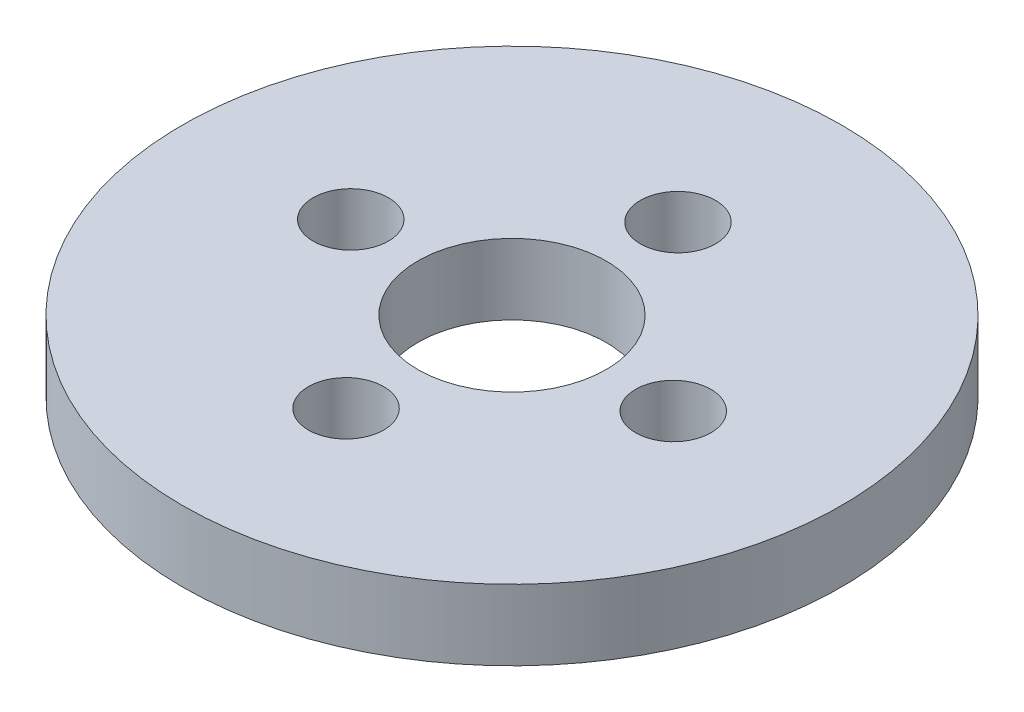
from build123d import *

# Parameters (mm, degrees)
SKETCH_1_R      = 14
SKETCH_1_R_2    = 4
SKETCH_1_R_3    = 1.6
EXTRUDE_1_DEPTH = 3


with BuildPart() as part:
    # 草图1 → 凸台-拉伸1 (new body)
    with BuildSketch(Plane(origin=(0, 0, 0), x_dir=(1, 0, 0), z_dir=(0, 1, 0))):
        with Locations(Location((0, 0, 0), (0, 0, 270))):
            Circle(SKETCH_1_R)
        with Locations(Location((0, 0, 0), (0, 0, 270))):
            Circle(SKETCH_1_R_2, mode=Mode.SUBTRACT)
        with Locations(Location((0.100073178, 6.949961639, 0), (0, 0, 270))):
            Circle(SKETCH_1_R_3, mode=Mode.SUBTRACT)
        with Locations(Location((6.949961639, -0.100073178, 0), (0, 0, 270))):
            Circle(SKETCH_1_R_3, mode=Mode.SUBTRACT)
        with Locations(Location((-0.100073178, -6.949961639, 0), (0, 0, 270))):
            Circle(SKETCH_1_R_3, mode=Mode.SUBTRACT)
        with Locations(Location((-6.949961639, 0.100073178, 0), (0, 0, 270))):
            Circle(SKETCH_1_R_3, mode=Mode.SUBTRACT)
    extrude(amount=EXTRUDE_1_DEPTH)


solid = part.part
